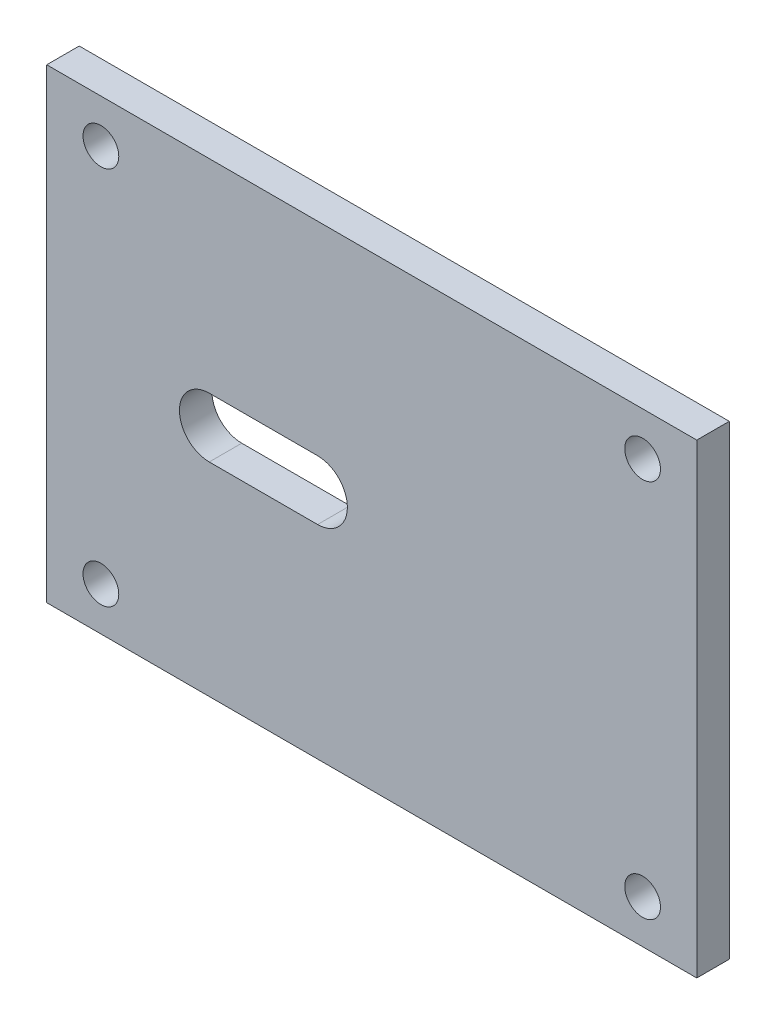
from build123d import *

# Parameters (mm, degrees)
SKETCH1_W           = 60
SKETCH1_H           = 43
SKETCH1_R           = 1.65
BOSS_EXTRUDE1_DEPTH = 3
CUT_EXTRUDE1_DEPTH  = 38.030392923


with BuildPart() as part:
    # Sketch1 → Boss-Extrude1 (new body)
    with BuildSketch(Plane.XY):
        Rectangle(SKETCH1_W, SKETCH1_H)
        with Locations((-25, 17.5)):
            Circle(SKETCH1_R, mode=Mode.SUBTRACT)
        with Locations((25, 17.5)):
            Circle(SKETCH1_R, mode=Mode.SUBTRACT)
        with Locations((25, -17.5)):
            Circle(SKETCH1_R, mode=Mode.SUBTRACT)
        with Locations((-25, -17.5)):
            Circle(SKETCH1_R, mode=Mode.SUBTRACT)
    extrude(amount=BOSS_EXTRUDE1_DEPTH)

    # Sketch2 → Cut-Extrude1 (cut, through all)
    with BuildSketch(Plane(origin=(0, 0, 0), x_dir=(-1, 0, 0), z_dir=(0, 0, -1))):
        with BuildLine():
            Line((15, -2.75), (5, -2.75))
            ThreePointArc((5, -2.75), (2.25, 0), (5, 2.75))
            Line((5, 2.75), (15, 2.75))
            ThreePointArc((15, 2.75), (17.75, 0), (15, -2.75))
        make_face()
    extrude(amount=-CUT_EXTRUDE1_DEPTH, mode=Mode.SUBTRACT)


solid = part.part
